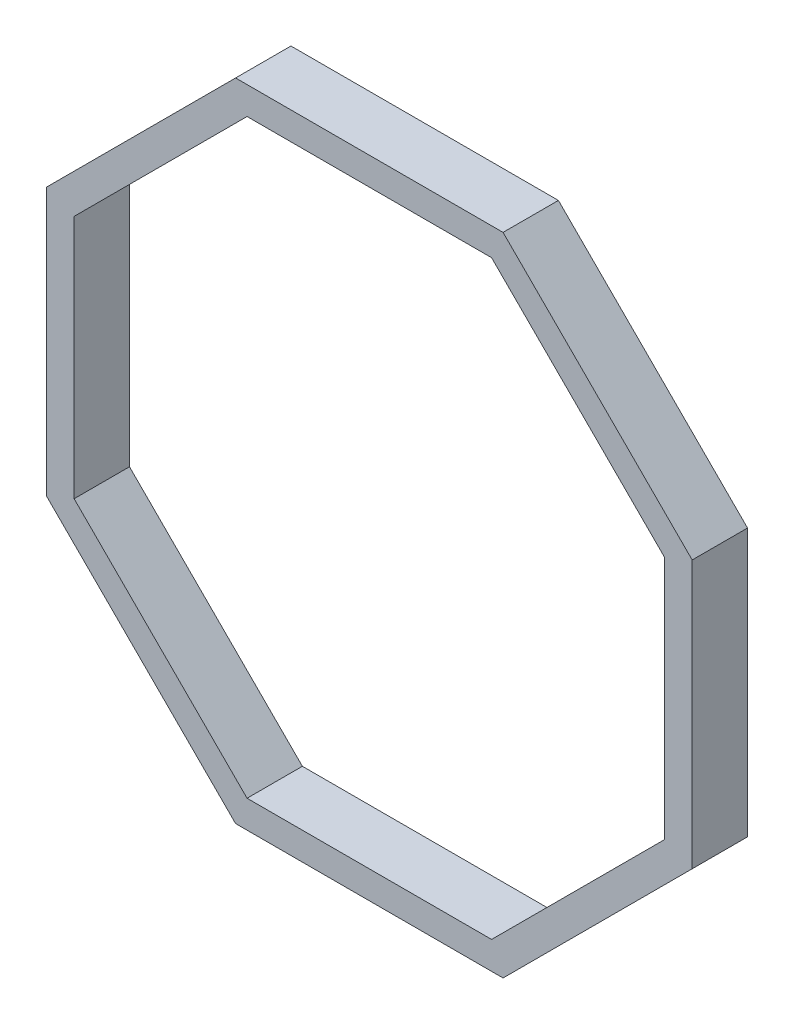
from build123d import *

# Parameters (mm, degrees)
RESSALTO_EXTRUS_O1_DEPTH = 30


with BuildPart() as part:
    # Esboço1 → Ressalto-extrusão1 (new body)
    with BuildSketch(Plane.XY):
        Polygon((175, 72.487373415), (72.487373415, 175), (-72.487373415, 175), (-175, 72.487373415), (-175, -72.487373415), (-72.487373415, -175), (72.487373415, -175), (175, -72.487373415), align=None)
        Polygon((160, 66.27416998), (66.27416998, 160), (-66.27416998, 160), (-160, 66.27416998), (-160, -66.27416998), (-66.27416998, -160), (66.27416998, -160), (160, -66.27416998), align=None, mode=Mode.SUBTRACT)
    extrude(amount=RESSALTO_EXTRUS_O1_DEPTH)


solid = part.part
